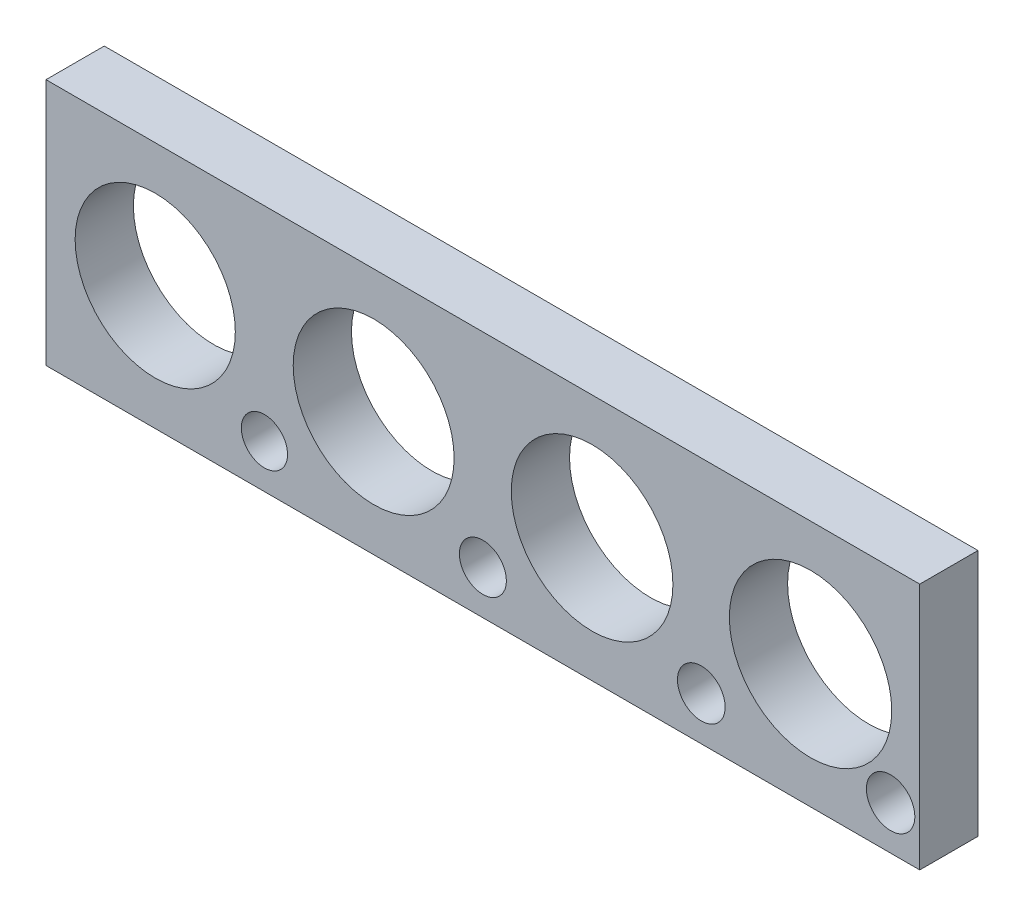
from build123d import *

# Parameters (mm, degrees)
COUPON_PLATE_PROFILE_W                     = 120
COUPON_PLATE_PROFILE_H                     = 34
COUPON_PLATE_DEPTH                         = 8
BEARING_FIT_TRIAL_THROUGH_START            = -1
BEARING_SEAT_TRIAL_22P0_22P1_22P2_22P3_R   = 11
BEARING_SEAT_TRIAL_22P0_22P1_22P2_22P3_R_2 = 11.05
BEARING_SEAT_TRIAL_22P0_22P1_22P2_22P3_R_3 = 11.1
BEARING_SEAT_TRIAL_22P0_22P1_22P2_22P3_R_4 = 11.15
BEARING_FIT_TRIAL_THROUGH_DEPTH            = 64.872887638
DOWEL_FIT_TRIAL_THROUGH_START              = -1
DOWEL_TRIAL_6P35_6P45_6P55_6P65_R          = 3.175
DOWEL_TRIAL_6P35_6P45_6P55_6P65_R_2        = 3.225
DOWEL_TRIAL_6P35_6P45_6P55_6P65_R_3        = 3.275
DOWEL_TRIAL_6P35_6P45_6P55_6P65_R_4        = 3.325
DOWEL_FIT_TRIAL_THROUGH_DEPTH              = 64.872887638


with BuildPart() as part:
    # Coupon_plate_profile → Coupon_plate (new body)
    with BuildSketch(Plane.XY):
        Rectangle(COUPON_PLATE_PROFILE_W, COUPON_PLATE_PROFILE_H)
    extrude(amount=COUPON_PLATE_DEPTH)

    # Bearing_seat_trial_22p0_22p1_22p2_22p3 → Bearing_fit_trial_through (cut, through all)
    with BuildSketch(Plane.XY.offset(BEARING_FIT_TRIAL_THROUGH_START)):
        with Locations(Location((-45, 0, 0), (0, 0, 180))):
            Circle(BEARING_SEAT_TRIAL_22P0_22P1_22P2_22P3_R)
        with Locations(Location((-15, 0, 0), (0, 0, 180))):
            Circle(BEARING_SEAT_TRIAL_22P0_22P1_22P2_22P3_R_2)
        with Locations(Location((15, 0, 0), (0, 0, 180))):
            Circle(BEARING_SEAT_TRIAL_22P0_22P1_22P2_22P3_R_3)
        with Locations(Location((45, 0, 0), (0, 0, 180))):
            Circle(BEARING_SEAT_TRIAL_22P0_22P1_22P2_22P3_R_4)
    extrude(amount=BEARING_FIT_TRIAL_THROUGH_DEPTH, mode=Mode.SUBTRACT)

    # Dowel_trial_6p35_6p45_6p55_6p65 → Dowel_fit_trial_through (cut, through all)
    with BuildSketch(Plane.XY.offset(DOWEL_FIT_TRIAL_THROUGH_START)):
        with Locations(Location((-30, -11, 0), (0, 0, 180))):
            Circle(DOWEL_TRIAL_6P35_6P45_6P55_6P65_R)
        with Locations(Location((0, -11, 0), (0, 0, 180))):
            Circle(DOWEL_TRIAL_6P35_6P45_6P55_6P65_R_2)
        with Locations(Location((30, -11, 0), (0, 0, 180))):
            Circle(DOWEL_TRIAL_6P35_6P45_6P55_6P65_R_3)
        with Locations(Location((56, -11, 0), (0, 0, 180))):
            Circle(DOWEL_TRIAL_6P35_6P45_6P55_6P65_R_4)
    extrude(amount=DOWEL_FIT_TRIAL_THROUGH_DEPTH, mode=Mode.SUBTRACT)


solid = part.part
